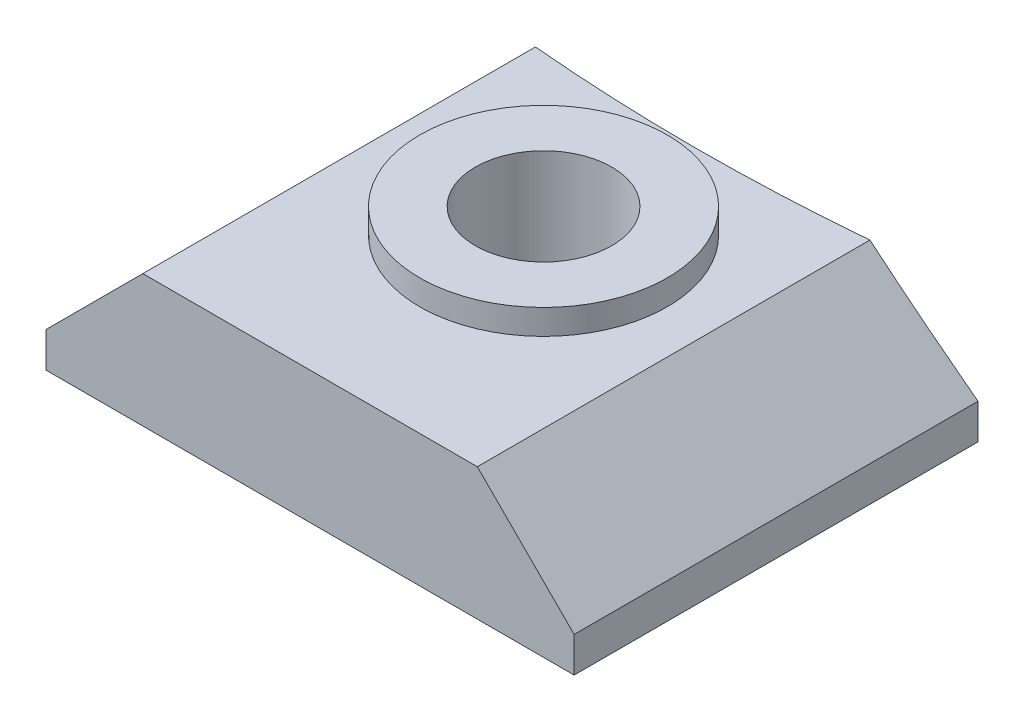
from build123d import *

# Parameters (mm, degrees)
BOSS_EXTRUDE1_DEPTH = 22
SKETCH2_R           = 5.625
BOSS_EXTRUDE2_DEPTH = 1.14
SKETCH3_R           = 3.1
CUT_EXTRUDE3_DEPTH  = 27.057236999
CUT_EXTRUDE4_DEPTH  = 26.768197453


with BuildPart() as part:
    # Sketch1 → Boss-Extrude1 (new body)
    with BuildSketch(Plane.XY):
        Polygon((-12, 0), (12, 0), (12, 1.6), (7.6, 6), (-7.6, 6), (-12, 1.6), align=None)
    extrude(amount=BOSS_EXTRUDE1_DEPTH)

    # Sketch2 → Boss-Extrude2 (add)
    with BuildSketch(Plane(origin=(0, 6, 0), x_dir=(1, 0, 0), z_dir=(0, 1, 0))):
        with Locations(Location((0, -11.391064781, 0), (0, 0, 180))):
            Circle(SKETCH2_R)
    extrude(amount=BOSS_EXTRUDE2_DEPTH)

    # Sketch3 → Cut-Extrude3 (cut, through all)
    with BuildSketch(Plane(origin=(0, 7.14, 0), x_dir=(1, 0, 0), z_dir=(0, 1, 0))):
        with Locations(Location((0, -11.391064781, 0), (0, 0, 180))):
            Circle(SKETCH3_R)
    extrude(amount=-CUT_EXTRUDE3_DEPTH, mode=Mode.SUBTRACT)

    # Sketch4 → Cut-Extrude4 (cut, through all)
    with BuildSketch(Plane(origin=(0, 6, 0), x_dir=(1, 0, 0), z_dir=(0, 1, 0))):
        with BuildLine():
            Line((-12, -3.648677946), (-12, 0))
            Line((-12, 0), (12, 0))
            Line((12, 0), (12, -3.648677946))
            ThreePointArc((12, -3.648677946), (0, -4.5), (-12, -3.648677946))
        make_face()
    extrude(amount=-CUT_EXTRUDE4_DEPTH, mode=Mode.SUBTRACT)


solid = part.part
